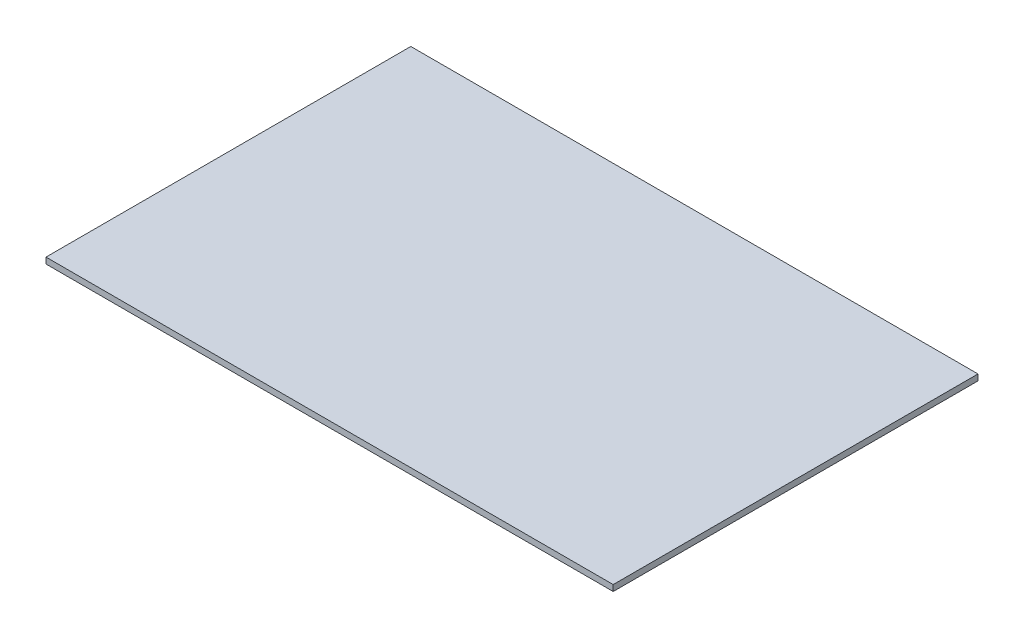
from build123d import *

# Parameters (mm, degrees)
SKETCH1_W           = 809.625
SKETCH1_H           = 520.7
BOSS_EXTRUDE1_DEPTH = 8.636


with BuildPart() as part:
    # Sketch1 → Boss-Extrude1 (new body)
    with BuildSketch(Plane(origin=(0, 0, 0), x_dir=(1, 0, 0), z_dir=(0, 1, 0))):
        Rectangle(SKETCH1_W, SKETCH1_H)
    extrude(amount=BOSS_EXTRUDE1_DEPTH)


solid = part.part
